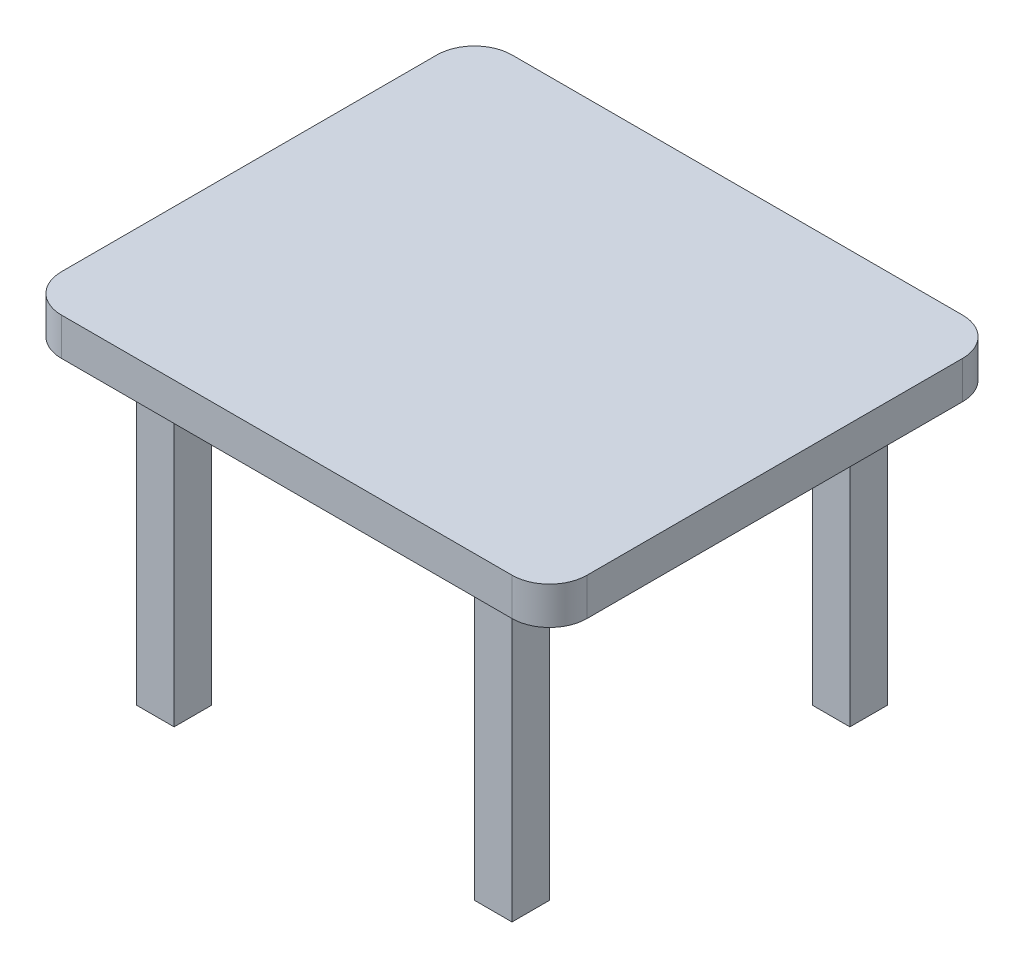
from build123d import *

# Parameters (mm, degrees)
SKETCH1_W             = 10
SKETCH1_H             = 10
BOSS_EXTRUDE1_DEPTH   = 80
BOSS_EXTRUDE1_2_DEPTH = 80
BOSS_EXTRUDE1_3_DEPTH = 80
BOSS_EXTRUDE1_4_DEPTH = 80
SKETCH2_W             = 140
SKETCH2_H             = 120
BOSS_EXTRUDE2_DEPTH   = 10
FILLET1_R             = 10


with BuildPart() as part:
    # Sketch1 → Boss-Extrude1 (new body)
    with BuildSketch(Plane(origin=(0, 0, 0), x_dir=(1, 0, 0), z_dir=(0, 1, 0))):
        with Locations((-5, 95)):
            Rectangle(SKETCH1_W, SKETCH1_H)
    extrude(amount=BOSS_EXTRUDE1_DEPTH)



with BuildPart() as body_2:
    # Sketch1 → Boss-Extrude1 2 (new body)
    with BuildSketch(Plane(origin=(0, 0, 0), x_dir=(1, 0, 0), z_dir=(0, 1, 0))):
        with Locations((-5, 5)):
            Rectangle(SKETCH1_W, SKETCH1_H)
    extrude(amount=BOSS_EXTRUDE1_2_DEPTH)


with BuildPart() as body_3:
    # Sketch1 → Boss-Extrude1 3 (new body)
    with BuildSketch(Plane(origin=(0, 0, 0), x_dir=(1, 0, 0), z_dir=(0, 1, 0))):
        with Locations((-95, 5)):
            Rectangle(SKETCH1_W, SKETCH1_H)
    extrude(amount=BOSS_EXTRUDE1_3_DEPTH)


with BuildPart() as body_4:
    # Sketch1 → Boss-Extrude1 4 (new body)
    with BuildSketch(Plane(origin=(0, 0, 0), x_dir=(1, 0, 0), z_dir=(0, 1, 0))):
        with Locations((-95, 95)):
            Rectangle(SKETCH1_W, SKETCH1_H)
    extrude(amount=BOSS_EXTRUDE1_4_DEPTH)


with BuildPart() as part_1:
    add(part.part)

    add(body_2.part)  # Boss-Extrude2 merges body 2

    add(body_3.part)  # Boss-Extrude2 merges body 3

    add(body_4.part)  # Boss-Extrude2 merges body 4
    # Sketch2 → Boss-Extrude2 (add)
    with BuildSketch(Plane(origin=(0, 80, 0), x_dir=(1, 0, 0), z_dir=(0, 1, 0))):
        with Locations((-50, 50)):
            Rectangle(SKETCH2_W, SKETCH2_H)
    extrude(amount=BOSS_EXTRUDE2_DEPTH)

    # Fillet1
    fillet1_edges = [part_1.edges().sort_by_distance(p)[0] for p in [
        (-120, 85, -110),
        (-120, 85, 10),
        (20, 85, 10),
        (20, 85, -110),
    ]]
    fillet(fillet1_edges, radius=FILLET1_R)


solid = part_1.part
